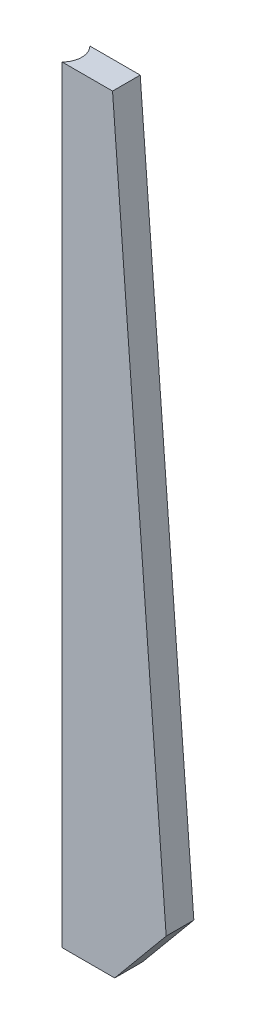
from build123d import *

# Parameters (mm, degrees)
BOSS_EXTRUDE1_DEPTH     = 15
SCALE1_SCALE            = 0.6
CUT_EXTRUDE2_DEPTH      = 414.628802078
CUT_EXTRUDE2_DEPTH_BACK = 414.628802078


with BuildPart() as part:
    # Sketch3 → Boss-Extrude1 (new body)
    with BuildSketch(Plane.XY):
        Polygon((373.374123275, 416.968077367), (402.437373481, 34.910153282), (374.539751445, 1.298077367), (346.074948764, 1.298077367), (346.074948764, 416.968077367), align=None)
    extrude(amount=BOSS_EXTRUDE1_DEPTH)


with BuildPart() as part_1:
    # Scale1: scaled about (367.849283485, 188.760033588, 7.5)
    add(part.part.scale(SCALE1_SCALE).moved(Location((147.139713394, 75.504013435, 3))))

    # Sketch9 → Cut-Extrude2 (cut, two sides: drawn at the far end of the back side and taken through both)
    with BuildSketch(Plane(origin=(0, 184.5, 0), x_dir=(1, 0, 0), z_dir=(0, 1, 0)).offset(-CUT_EXTRUDE2_DEPTH_BACK)):
        with BuildLine():
            Line((354.784682653, -12), (354.784682653, -3))
            ThreePointArc((354.784682653, -3), (356.648643683, -7.5), (354.784682653, -12))
        make_face()
    extrude(amount=CUT_EXTRUDE2_DEPTH + CUT_EXTRUDE2_DEPTH_BACK, mode=Mode.SUBTRACT)


solid = part_1.part
